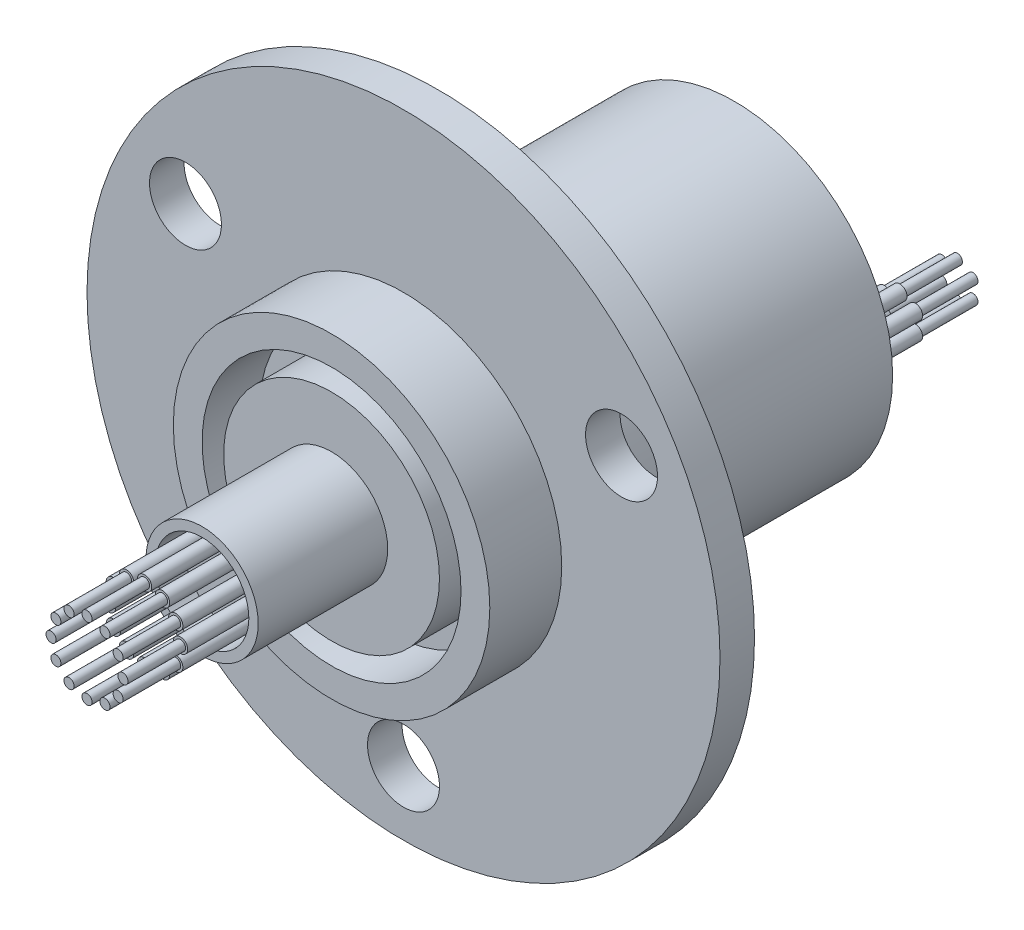
from build123d import *

# Parameters (mm, degrees)
IZIM1_R                     = 11
Y_KSEKLIK_EKSTR_ZYON1_DEPTH = 28
IZIM2_R                     = 22
Y_KSEKLIK_EKSTR_ZYON2_DEPTH = 2.4
IZIM3_R                     = 2.5
KES_EKSTR_ZYON1_DEPTH       = 10
IZIM4_R                     = 3.9
Y_KSEKLIK_EKSTR_ZYON3_DEPTH = 9
IZIM6_R                     = 3.25
KES_EKSTR_ZYON3_DEPTH       = 2
IZIM7_R                     = 0.5
Y_KSEKLIK_EKSTR_ZYON5_DEPTH = 6
IZIM8_R                     = 0.35
Y_KSEKLIK_EKSTR_ZYON6_DEPTH = 4
IZIM9_R                     = 2
KES_EKSTR_ZYON4_DEPTH       = 2
IZIM10_R                    = 0.5
Y_KSEKLIK_EKSTR_ZYON7_DEPTH = 6
IZIM12_R                    = 9
IZIM12_R_2                  = 7.5
KES_EKSTR_ZYON5_DEPTH       = 4
IZIM13_R                    = 0.35
Y_KSEKLIK_EKSTR_ZYON8_DEPTH = 4


with BuildPart() as part:
    # Çizim1 → Yükseklik-Ekstrüzyon1 (new body)
    with BuildSketch(Plane.XY):
        Circle(IZIM1_R)
    extrude(amount=Y_KSEKLIK_EKSTR_ZYON1_DEPTH)

    # Çizim2 → Yükseklik-Ekstrüzyon2 (add)
    with BuildSketch(Plane.XY.offset(23)):
        Circle(IZIM2_R)
    extrude(amount=-Y_KSEKLIK_EKSTR_ZYON2_DEPTH)

    # Çizim3 → Kes-Ekstrüzyon1 (cut)
    with BuildSketch(Plane.XY.offset(23)):
        with Locations((0, -17.5)):
            Circle(IZIM3_R)
        with Locations((-15.155444566, 8.75)):
            Circle(IZIM3_R)
        with Locations((15.155444566, 8.75)):
            Circle(IZIM3_R)
    extrude(amount=-KES_EKSTR_ZYON1_DEPTH, mode=Mode.SUBTRACT)

    # Çizim4 → Yükseklik-Ekstrüzyon3 (add)
    with BuildSketch(Plane.XY.offset(28)):
        Circle(IZIM4_R)
    extrude(amount=Y_KSEKLIK_EKSTR_ZYON3_DEPTH)

    # Çizim6 → Kes-Ekstrüzyon3 (cut)
    with BuildSketch(Plane.XY.offset(37)):
        Circle(IZIM6_R)
    extrude(amount=-KES_EKSTR_ZYON3_DEPTH, mode=Mode.SUBTRACT)

    # Çizim7 → Yükseklik-Ekstrüzyon5 (add)
    with BuildSketch(Plane.XY.offset(35)):
        with Locations((0, 2.5)):
            Circle(IZIM7_R)
        with Locations((1.25, 2.165063509)):
            Circle(IZIM7_R)
        with Locations((2.165063509, 1.25)):
            Circle(IZIM7_R)
        with Locations((2.5, 0)):
            Circle(IZIM7_R)
        with Locations((2.165063509, -1.25)):
            Circle(IZIM7_R)
        with Locations((1.25, -2.165063509)):
            Circle(IZIM7_R)
        with Locations((0, -2.5)):
            Circle(IZIM7_R)
        with Locations((-1.25, -2.165063509)):
            Circle(IZIM7_R)
        with Locations((-2.165063509, -1.25)):
            Circle(IZIM7_R)
        with Locations((-2.5, 0)):
            Circle(IZIM7_R)
        with Locations((-2.165063509, 1.25)):
            Circle(IZIM7_R)
        with Locations((-1.25, 2.165063509)):
            Circle(IZIM7_R)
    extrude(amount=Y_KSEKLIK_EKSTR_ZYON5_DEPTH)

    # Çizim8 → Yükseklik-Ekstrüzyon6 (add)
    with BuildSketch(Plane.XY.offset(41)):
        with Locations((0, 2.5)):
            Circle(IZIM8_R)
        with Locations((1.25, 2.165063509)):
            Circle(IZIM8_R)
        with Locations((2.165063509, 1.25)):
            Circle(IZIM8_R)
        with Locations((2.5, 0)):
            Circle(IZIM8_R)
        with Locations((2.165063509, -1.25)):
            Circle(IZIM8_R)
        with Locations((1.25, -2.165063509)):
            Circle(IZIM8_R)
        with Locations((0, -2.5)):
            Circle(IZIM8_R)
        with Locations((-1.25, -2.165063509)):
            Circle(IZIM8_R)
        with Locations((-2.165063509, -1.25)):
            Circle(IZIM8_R)
        with Locations((-2.5, 0)):
            Circle(IZIM8_R)
        with Locations((-2.165063509, 1.25)):
            Circle(IZIM8_R)
        with Locations((-1.25, 2.165063509)):
            Circle(IZIM8_R)
    extrude(amount=Y_KSEKLIK_EKSTR_ZYON6_DEPTH)

    # Çizim9 → Kes-Ekstrüzyon4 (cut)
    with BuildSketch(Plane(origin=(0, 0, 0), x_dir=(-1, 0, 0), z_dir=(0, 0, -1))):
        with Locations((-7.5, 0)):
            Circle(IZIM9_R)
        with Locations((7.5, 0)):
            Circle(IZIM9_R)
    extrude(amount=-KES_EKSTR_ZYON4_DEPTH, mode=Mode.SUBTRACT)

    # Çizim10 → Yükseklik-Ekstrüzyon7 (add)
    with BuildSketch(Plane(origin=(0, 0, 2), x_dir=(-1, 0, 0), z_dir=(0, 0, -1))):
        with Locations((7.5, 1.25)):
            Circle(IZIM10_R)
        with Locations((8.582531755, 0.625)):
            Circle(IZIM10_R)
        with Locations((8.582531755, -0.625)):
            Circle(IZIM10_R)
        with Locations((7.5, -1.25)):
            Circle(IZIM10_R)
        with Locations(Location((-6.417468245, 0.625, 0), (0, 0, 180))):
            Circle(IZIM10_R)
        with Locations(Location((-6.417468245, -0.625, 0), (0, 0, 180))):
            Circle(IZIM10_R)
        with Locations(Location((-7.5, -1.25, 0), (0, 0, 180))):
            Circle(IZIM10_R)
        with Locations(Location((-8.582531755, -0.625, 0), (0, 0, 180))):
            Circle(IZIM10_R)
        with Locations((6.417468245, -0.625)):
            Circle(IZIM10_R)
        with Locations((6.417468245, 0.625)):
            Circle(IZIM10_R)
        with Locations(Location((-8.582531755, 0.625, 0), (0, 0, 180))):
            Circle(IZIM10_R)
        with Locations(Location((-7.5, 1.25, 0), (0, 0, 180))):
            Circle(IZIM10_R)
    extrude(amount=Y_KSEKLIK_EKSTR_ZYON7_DEPTH)

    # Çizim12 → Kes-Ekstrüzyon5 (cut)
    with BuildSketch(Plane.XY.offset(28)):
        Circle(IZIM12_R)
        Circle(IZIM12_R_2, mode=Mode.SUBTRACT)
    extrude(amount=-KES_EKSTR_ZYON5_DEPTH, mode=Mode.SUBTRACT)

    # Çizim13 → Yükseklik-Ekstrüzyon8 (add)
    with BuildSketch(Plane(origin=(0, 0, -4), x_dir=(-1, 0, 0), z_dir=(0, 0, -1))):
        with Locations((7.5, 1.25)):
            Circle(IZIM13_R)
        with Locations((8.582531755, 0.625)):
            Circle(IZIM13_R)
        with Locations((8.582531755, -0.625)):
            Circle(IZIM13_R)
        with Locations((7.5, -1.25)):
            Circle(IZIM13_R)
        with Locations((6.417468245, -0.625)):
            Circle(IZIM13_R)
        with Locations((6.417468245, 0.625)):
            Circle(IZIM13_R)
        with Locations(Location((-6.417468245, 0.625, 0), (0, 0, 180))):
            Circle(IZIM13_R)
        with Locations(Location((-6.417468245, -0.625, 0), (0, 0, 180))):
            Circle(IZIM13_R)
        with Locations(Location((-7.5, -1.25, 0), (0, 0, 180))):
            Circle(IZIM13_R)
        with Locations(Location((-8.582531755, -0.625, 0), (0, 0, 180))):
            Circle(IZIM13_R)
        with Locations(Location((-8.582531755, 0.625, 0), (0, 0, 180))):
            Circle(IZIM13_R)
        with Locations(Location((-7.5, 1.25, 0), (0, 0, 180))):
            Circle(IZIM13_R)
    extrude(amount=Y_KSEKLIK_EKSTR_ZYON8_DEPTH)


solid = part.part
